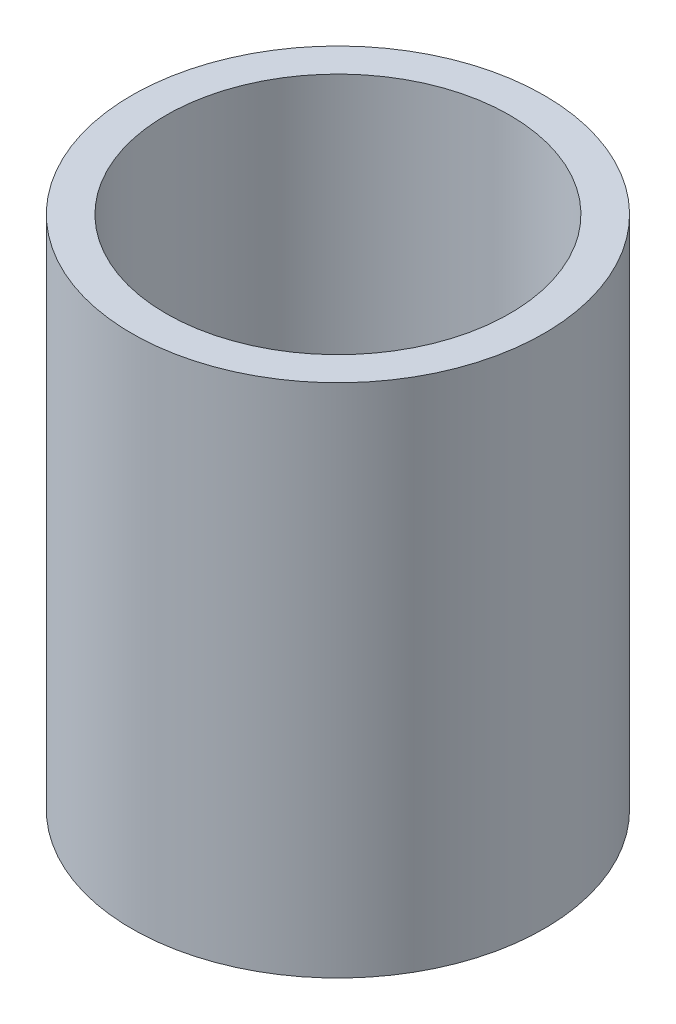
from build123d import *

# Parameters (mm, degrees)
SKETCH1_R           = 18
SKETCH1_R_2         = 15
BOSS_EXTRUDE1_DEPTH = 45


with BuildPart() as part:
    # Sketch1 → Boss-Extrude1 (new body)
    with BuildSketch(Plane(origin=(0, 0, 0), x_dir=(1, 0, 0), z_dir=(0, 1, 0))):
        with Locations(Location((0, 0.545038043, 0), (0, 0, 90))):
            Circle(SKETCH1_R)
        with Locations(Location((0, 0.545038043, 0), (0, 0, 90))):
            Circle(SKETCH1_R_2, mode=Mode.SUBTRACT)
    extrude(amount=BOSS_EXTRUDE1_DEPTH)


solid = part.part
